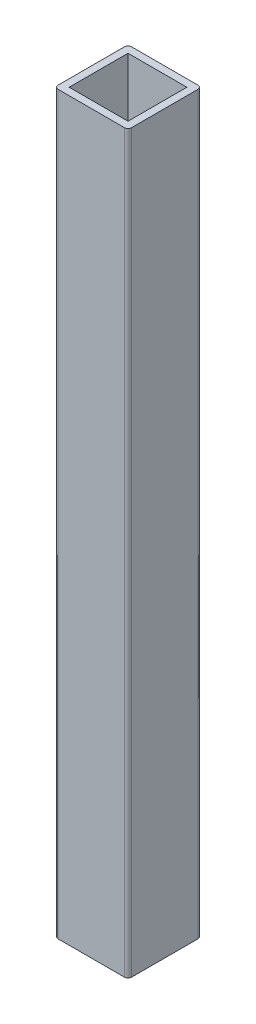
from build123d import *

# Parameters (mm, degrees)
SKETCH1_W           = 20
SKETCH1_H           = 20
SKETCH1_W_2         = 16
SKETCH1_H_2         = 16
BOSS_EXTRUDE1_DEPTH = 200
FILLET1_R           = 1


with BuildPart() as part:
    # Sketch1 → Boss-Extrude1 (new body)
    with BuildSketch(Plane(origin=(0, 0, 0), x_dir=(1, 0, 0), z_dir=(0, 1, 0))):
        with Locations((0.843373494, -1.807228916)):
            Rectangle(SKETCH1_W, SKETCH1_H)
        with Locations((0.843373494, -1.807228916)):
            Rectangle(SKETCH1_W_2, SKETCH1_H_2, mode=Mode.SUBTRACT)
    extrude(amount=BOSS_EXTRUDE1_DEPTH)

    # Fillet1
    fillet1_edges = [part.edges().sort_by_distance(p)[0] for p in [
        (-9.156626506, 100, -8.192771084),
        (10.843373494, 100, -8.192771084),
        (10.843373494, 100, 11.807228916),
        (-9.156626506, 100, 11.807228916),
    ]]
    fillet(fillet1_edges, radius=FILLET1_R)


solid = part.part
